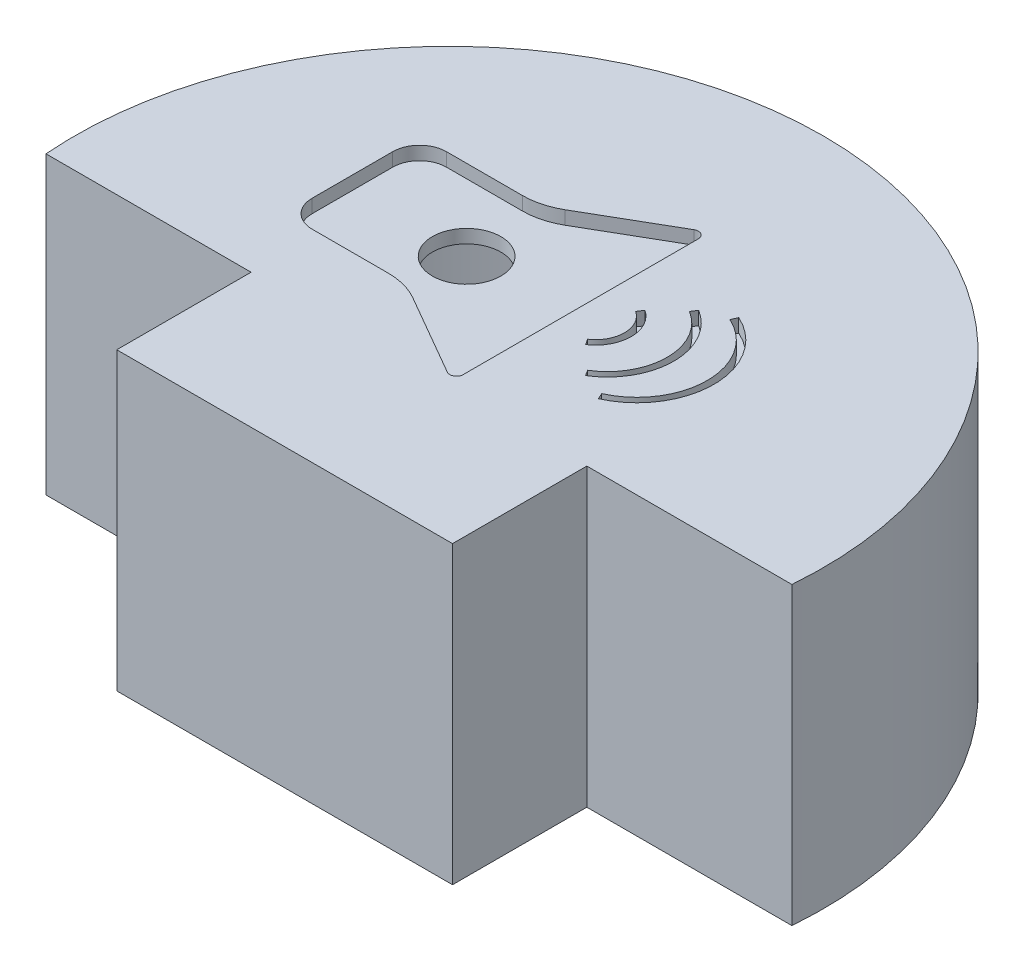
from build123d import *

# Parameters (mm, degrees)
EXTRUIR_L_MINA1_DEPTH        = 20
SALIENTE_EXTRUIR1_DEPTH      = 2
CORTAR_EXTRUIR1_DEPTH        = 1
CORTAR_EXTRUIR_L_MINA2_DEPTH = 1
CROQUIS7_R                   = 2.55
CORTAR_EXTRUIR2_DEPTH        = 11
EXTRUIR_L_MINA2_DEPTH        = 2.5


with BuildPart() as part:
    # Croquis1 → Extruir-Lámina1 (new body)
    with BuildSketch(Plane(origin=(0, 0, 0), x_dir=(1, 0, 0), z_dir=(0, 1, 0))):
        with BuildLine():
            Line((-27.77, 10), (-12.5, 10))
            Line((-12.5, 10), (-12.5, 0))
            Line((-12.5, 0), (12.5, 0))
            Line((12.5, 0), (12.5, 10))
            Line((12.5, 10), (27.77, 10))
            ThreePointArc((27.77, 10), (0, 40.097565641), (-27.77, 10))
        make_face()
        with BuildLine():
            Line((-25.858908766, 12), (-10.5, 12))
            Line((-10.5, 12), (-10.5, 2))
            Line((-10.5, 2), (10.5, 2))
            Line((10.5, 2), (10.5, 12))
            Line((10.5, 12), (25.858908766, 12))
            ThreePointArc((25.858908766, 12), (0, 38.097565641), (-25.858908766, 12))
        make_face(mode=Mode.SUBTRACT)
    extrude(amount=EXTRUIR_L_MINA1_DEPTH)

    # Croquis2 → Saliente-Extruir1 (add)
    with BuildSketch(Plane(origin=(0, 20, 0), x_dir=(1, 0, 0), z_dir=(0, 1, 0))):
        with BuildLine():
            Line((12.5, 10), (27.77, 10))
            ThreePointArc((27.77, 10), (0, 40.097565641), (-27.77, 10))
            Line((-27.77, 10), (-12.5, 10))
            Line((-12.5, 10), (-12.5, 0))
            Line((-12.5, 0), (12.5, 0))
            Line((12.5, 0), (12.5, 10))
        make_face()
    extrude(amount=SALIENTE_EXTRUIR1_DEPTH)

    # Croquis3 → Cortar-Extruir1 (cut)
    with BuildSketch(Plane(origin=(0, 22, 0), x_dir=(1, 0, 0), z_dir=(0, 1, 0))):
        with BuildLine():
            Line((-15, 23.048782821), (-15, 17.048782821))
            ThreePointArc((-15, 17.048782821), (-14.414213562, 15.634569258), (-13, 15.048782821))
            Line((-13, 15.048782821), (-7.339745962, 15.048782821))
            ThreePointArc((-7.339745962, 15.048782821), (-6.045650737, 14.878411952), (-4.839745962, 14.37890984))
            Line((-4.839745962, 14.37890984), (1.25, 10.862993369))
            ThreePointArc((1.25, 10.862993369), (1.75, 10.862993369), (2, 11.296006071))
            Line((2, 11.296006071), (2, 28.80155957))
            ThreePointArc((2, 28.80155957), (1.75, 29.234572272), (1.25, 29.234572272))
            Line((1.25, 29.234572272), (-4.839745962, 25.718655802))
            ThreePointArc((-4.839745962, 25.718655802), (-6.045650737, 25.219153689), (-7.339745962, 25.048782821))
            Line((-7.339745962, 25.048782821), (-13, 25.048782821))
            ThreePointArc((-13, 25.048782821), (-14.414213562, 24.462996383), (-15, 23.048782821))
        make_face()
    extrude(amount=-CORTAR_EXTRUIR1_DEPTH, mode=Mode.SUBTRACT)

    # Croquis4 → Cortar-Extruir-Lámina2 (cut)
    with BuildSketch(Plane(origin=(0, 22, 0), x_dir=(1, 0, 0), z_dir=(0, 1, 0))):
        with BuildLine():
            ThreePointArc((4.344585076, 21.79004299), (5.307052977, 19.99849463), (4.344585076, 18.206946269))
            Line((4.344585076, 18.206946269), (4.620613436, 17.79004299))
            ThreePointArc((4.620613436, 17.79004299), (5.807052977, 19.99849463), (4.620613436, 22.206946269))
            Line((4.620613436, 22.206946269), (4.344585076, 21.79004299))
        make_face()
        with BuildLine():
            ThreePointArc((6.352562942, 23.784975176), (8.479957679, 19.99849463), (6.352562942, 16.212014083))
            Line((6.352562942, 16.212014083), (6.612635571, 15.784975176))
            ThreePointArc((6.612635571, 15.784975176), (8.979957679, 19.99849463), (6.612635571, 24.212014083))
            Line((6.612635571, 24.212014083), (6.352562942, 23.784975176))
        make_face()
        with BuildLine():
            ThreePointArc((8.380144543, 24.770452897), (11.467649375, 19.99849463), (8.380144543, 15.226536362))
            Line((8.380144543, 15.226536362), (8.58505397, 14.770452897))
            ThreePointArc((8.58505397, 14.770452897), (11.967649375, 19.99849463), (8.58505397, 25.226536362))
            Line((8.58505397, 25.226536362), (8.380144543, 24.770452897))
        make_face()
    extrude(amount=-CORTAR_EXTRUIR_L_MINA2_DEPTH, mode=Mode.SUBTRACT)

    # Croquis7 → Cortar-Extruir2 (cut)
    with BuildSketch(Plane(origin=(0, 22, 0), x_dir=(1, 0, 0), z_dir=(0, 1, 0))):
        with Locations(Location((-6.5, 20.048782821, 0), (0, 0, 270))):
            Circle(CROQUIS7_R)
    extrude(amount=-CORTAR_EXTRUIR2_DEPTH, mode=Mode.SUBTRACT)


with BuildPart() as body_2:
    # Croquis9 → Extruir-Lámina2 (new body)
    with BuildSketch(Plane(origin=(0, 4.9, 0), x_dir=(-1, 0, 0), z_dir=(0, -1, 0))):
        with BuildLine():
            Line((-26.105447319, 11.75), (-10.75, 11.75))
            Line((-10.75, 11.75), (-10.75, 1.75))
            Line((-10.75, 1.75), (10.75, 1.75))
            Line((10.75, 1.75), (10.75, 11.75))
            Line((10.75, 11.75), (26.105447319, 11.75))
            ThreePointArc((26.105447319, 11.75), (0, 38.347565641), (-26.105447319, 11.75))
        make_face()
        with BuildLine():
            Line((-23.524077197, 14.25), (-8.25, 14.25))
            Line((-8.25, 14.25), (-8.25, 4.25))
            Line((-8.25, 4.25), (8.25, 4.25))
            Line((8.25, 4.25), (8.25, 14.25))
            Line((8.25, 14.25), (23.524077197, 14.25))
            ThreePointArc((23.524077197, 14.25), (0, 35.847565641), (-23.524077197, 14.25))
        make_face(mode=Mode.SUBTRACT)
    extrude(amount=EXTRUIR_L_MINA2_DEPTH)


solid = Compound([part.part, body_2.part])
